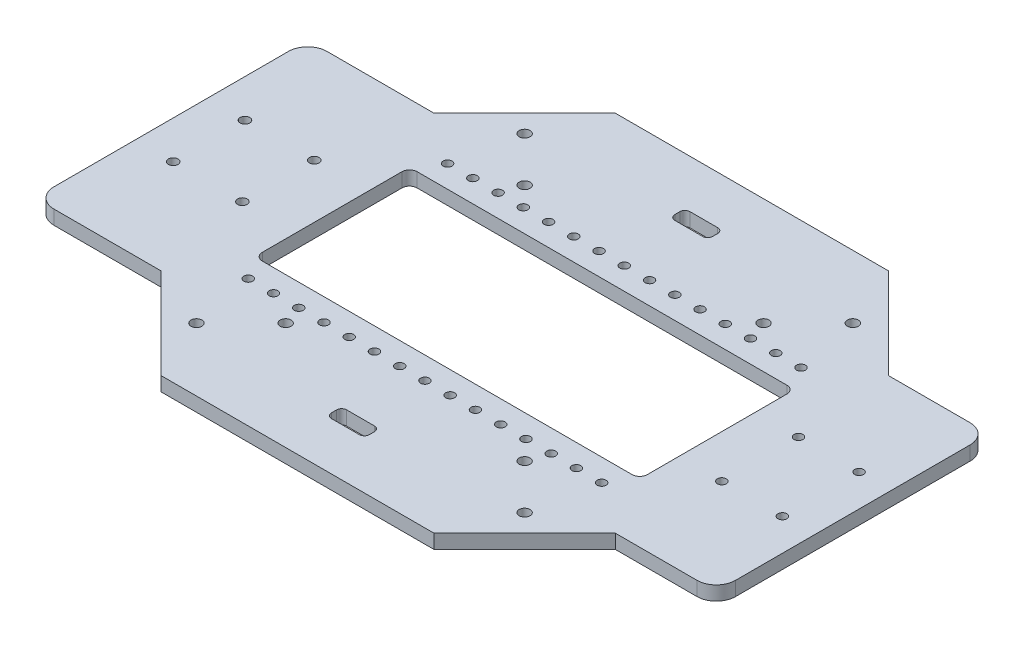
from build123d import *

# Parameters (mm, degrees)
BOSS_EXTRUDE1_DEPTH = 5.588
SKETCH2_R           = 2.159
CUT_EXTRUDE1_DEPTH  = 158.413946399
SKETCH3_W           = 152.51
SKETCH3_H           = 61.34
CUT_EXTRUDE2_DEPTH  = 158.413946399
BOSS_EXTRUDE2_DEPTH = 5.588
BOSS_EXTRUDE3_DEPTH = 5.588
SKETCH7_R           = 1.75
CUT_EXTRUDE4_DEPTH  = 187.865769606
SKETCH9_R           = 1.75
CUT_EXTRUDE8_DEPTH  = 187.865769606
CUT_EXTRUDE9_DEPTH  = 187.865769606
FILLET1_R           = 3
SKETCH11_R          = 1.905
CUT_EXTRUDE10_DEPTH = 187.865769606


with BuildPart() as part:
    # Sketch1 → Boss-Extrude1 (new body)
    with BuildSketch(Plane(origin=(0, 0, 0), x_dir=(1, 0, 0), z_dir=(0, 1, 0))):
        Polygon((-73.254183378, 28.522688753), (-37.333158894, 64.443713237), (70.824792138, 64.443713237), (106.745816622, 28.522688753), (106.745816622, -79.635262279), (70.824792138, -115.556286763), (-37.333158894, -115.556286763), (-73.254183378, -79.635262279), align=None)
    extrude(amount=BOSS_EXTRUDE1_DEPTH)

    # Sketch2 → Cut-Extrude1 (cut, through all)
    with BuildSketch(Plane(origin=(0, 5.588, 0), x_dir=(1, 0, 0), z_dir=(0, 1, 0))):
        with Locations(Location((-48.254183378, 39.443713237, 0), (0, 0, 270))):
            Circle(SKETCH2_R)
        with Locations(Location((-30.576513848, 21.766043708, 0), (0, 0, 270))):
            Circle(SKETCH2_R)
        with Locations(Location((-48.254183378, -90.556286763, 0), (0, 0, 270))):
            Circle(SKETCH2_R)
        with Locations(Location((-30.576513848, -72.878617233, 0), (0, 0, 270))):
            Circle(SKETCH2_R)
        with Locations(Location((64.068147093, 21.766043708, 0), (0, 0, 270))):
            Circle(SKETCH2_R)
        with Locations(Location((81.745816622, 39.443713237, 0), (0, 0, 270))):
            Circle(SKETCH2_R)
        with Locations(Location((64.068147093, -72.878617233, 0), (0, 0, 270))):
            Circle(SKETCH2_R)
        with Locations(Location((81.745816622, -90.556286763, 0), (0, 0, 270))):
            Circle(SKETCH2_R)
    extrude(amount=-CUT_EXTRUDE1_DEPTH, mode=Mode.SUBTRACT)

    # Sketch3 → Cut-Extrude2 (cut, through all)
    with BuildSketch(Plane(origin=(0, 5.588, 0), x_dir=(1, 0, 0), z_dir=(0, 1, 0))):
        with Locations((16.745816622, -25.556286763)):
            Rectangle(SKETCH3_W, SKETCH3_H)
    extrude(amount=-CUT_EXTRUDE2_DEPTH, mode=Mode.SUBTRACT)

    # Sketch5 → Boss-Extrude2 (add)
    with BuildSketch(Plane(origin=(0, 5.588, 0), x_dir=(1, 0, 0), z_dir=(0, 1, 0))):
        with BuildLine():
            Line((-73.254183378, -79.635262279), (-115.634183378, -79.635262279))
            ThreePointArc((-115.634183378, -79.635262279), (-121.02233705, -77.403415951), (-123.254183378, -72.015262279))
            Line((-123.254183378, -72.015262279), (-123.254183378, 20.902688753))
            ThreePointArc((-123.254183378, 20.902688753), (-121.02233705, 26.290842426), (-115.634183378, 28.522688753))
            Line((-115.634183378, 28.522688753), (-73.254183378, 28.522688753))
            Line((-73.254183378, 28.522688753), (-73.254183378, -79.635262279))
        make_face()
    extrude(amount=-BOSS_EXTRUDE2_DEPTH)

    # Sketch6 → Boss-Extrude3 (add)
    with BuildSketch(Plane(origin=(0, 5.588, 0), x_dir=(1, 0, 0), z_dir=(0, 1, 0))):
        with BuildLine():
            Line((106.745816622, 28.522688753), (139.125816622, 28.522688753))
            ThreePointArc((139.125816622, 28.522688753), (144.513970295, 26.290842426), (146.745816622, 20.902688753))
            Line((146.745816622, 20.902688753), (146.745816622, -72.015262279))
            ThreePointArc((146.745816622, -72.015262279), (144.513970295, -77.403415951), (139.125816622, -79.635262279))
            Line((139.125816622, -79.635262279), (106.745816622, -79.635262279))
            Line((106.745816622, -79.635262279), (106.745816622, 28.522688753))
        make_face()
    extrude(amount=-BOSS_EXTRUDE3_DEPTH)

    # Sketch7 → Cut-Extrude4 (cut, through all)
    with BuildSketch(Plane(origin=(0, 5.588, 0), x_dir=(1, 0, 0), z_dir=(0, 1, 0))):
        with Locations(Location((110.045816622, -10.356286763, 0), (0, 0, 270))):
            Circle(SKETCH7_R)
        with Locations(Location((134.045816622, -10.356286763, 0), (0, 0, 270))):
            Circle(SKETCH7_R)
        with Locations(Location((110.045816622, -40.756286763, 0), (0, 0, 270))):
            Circle(SKETCH7_R)
        with Locations(Location((134.045816622, -40.756286763, 0), (0, 0, 270))):
            Circle(SKETCH7_R)
    extrude(amount=-CUT_EXTRUDE4_DEPTH, mode=Mode.SUBTRACT)

    # Sketch9 → Cut-Extrude8 (cut, through all)
    with BuildSketch(Plane(origin=(0, 5.588, 0), x_dir=(1, 0, 0), z_dir=(0, 1, 0))):
        with Locations(Location((-53.254183378, 13.923713237, 0), (0, 0, 270))):
            Circle(SKETCH9_R)
        with Locations(Location((-43.254183378, 13.923713237, 0), (0, 0, 270))):
            Circle(SKETCH9_R)
        with Locations(Location((-33.254183378, 13.923713237, 0), (0, 0, 270))):
            Circle(SKETCH9_R)
        with Locations(Location((-23.254183378, 13.923713237, 0), (0, 0, 270))):
            Circle(SKETCH9_R)
        with Locations(Location((-13.254183378, 13.923713237, 0), (0, 0, 270))):
            Circle(SKETCH9_R)
        with Locations(Location((-3.254183378, 13.923713237, 0), (0, 0, 270))):
            Circle(SKETCH9_R)
        with Locations(Location((6.745816622, 13.923713237, 0), (0, 0, 270))):
            Circle(SKETCH9_R)
        with Locations(Location((16.745816622, 13.923713237, 0), (0, 0, 270))):
            Circle(SKETCH9_R)
        with Locations(Location((26.745816622, 13.923713237, 0), (0, 0, 270))):
            Circle(SKETCH9_R)
        with Locations(Location((36.745816622, 13.923713237, 0), (0, 0, 270))):
            Circle(SKETCH9_R)
        with Locations(Location((46.745816622, 13.923713237, 0), (0, 0, 270))):
            Circle(SKETCH9_R)
        with Locations(Location((56.745816622, 13.923713237, 0), (0, 0, 270))):
            Circle(SKETCH9_R)
        with Locations(Location((66.745816622, 13.923713237, 0), (0, 0, 270))):
            Circle(SKETCH9_R)
        with Locations(Location((76.745816622, 13.923713237, 0), (0, 0, 270))):
            Circle(SKETCH9_R)
        with Locations(Location((86.745816622, 13.923713237, 0), (0, 0, 270))):
            Circle(SKETCH9_R)
        with Locations(Location((-53.254183378, -65.036286763, 0), (0, 0, 270))):
            Circle(SKETCH9_R)
        with Locations(Location((-43.254183378, -65.036286763, 0), (0, 0, 270))):
            Circle(SKETCH9_R)
        with Locations(Location((-33.254183378, -65.036286763, 0), (0, 0, 270))):
            Circle(SKETCH9_R)
        with Locations(Location((-23.254183378, -65.036286763, 0), (0, 0, 270))):
            Circle(SKETCH9_R)
        with Locations(Location((-13.254183378, -65.036286763, 0), (0, 0, 270))):
            Circle(SKETCH9_R)
        with Locations(Location((-3.254183378, -65.036286763, 0), (0, 0, 270))):
            Circle(SKETCH9_R)
        with Locations(Location((6.745816622, -65.036286763, 0), (0, 0, 270))):
            Circle(SKETCH9_R)
        with Locations(Location((16.745816622, -65.036286763, 0), (0, 0, 270))):
            Circle(SKETCH9_R)
        with Locations(Location((26.745816622, -65.036286763, 0), (0, 0, 270))):
            Circle(SKETCH9_R)
        with Locations(Location((36.745816622, -65.036286763, 0), (0, 0, 270))):
            Circle(SKETCH9_R)
        with Locations(Location((46.745816622, -65.036286763, 0), (0, 0, 270))):
            Circle(SKETCH9_R)
        with Locations(Location((56.745816622, -65.036286763, 0), (0, 0, 270))):
            Circle(SKETCH9_R)
        with Locations(Location((66.745816622, -65.036286763, 0), (0, 0, 270))):
            Circle(SKETCH9_R)
        with Locations(Location((76.745816622, -65.036286763, 0), (0, 0, 270))):
            Circle(SKETCH9_R)
        with Locations(Location((86.745816622, -65.036286763, 0), (0, 0, 270))):
            Circle(SKETCH9_R)
    extrude(amount=-CUT_EXTRUDE8_DEPTH, mode=Mode.SUBTRACT)

    # Sketch10 → Cut-Extrude9 (cut, through all)
    with BuildSketch(Plane(origin=(0, 5.588, 0), x_dir=(1, 0, 0), z_dir=(0, 1, 0))):
        with BuildLine():
            Line((11.245816622, 45.443713237), (22.245816622, 45.443713237))
            ThreePointArc((22.245816622, 45.443713237), (23.660030185, 44.8579268), (24.245816622, 43.443713237))
            Line((24.245816622, 43.443713237), (24.245816622, 41.443713237))
            ThreePointArc((24.245816622, 41.443713237), (23.660030185, 40.029499675), (22.245816622, 39.443713237))
            Line((22.245816622, 39.443713237), (11.245816622, 39.443713237))
            ThreePointArc((11.245816622, 39.443713237), (9.83160306, 40.029499675), (9.245816622, 41.443713237))
            Line((9.245816622, 41.443713237), (9.245816622, 43.443713237))
            ThreePointArc((9.245816622, 43.443713237), (9.83160306, 44.8579268), (11.245816622, 45.443713237))
        make_face()
        with BuildLine():
            Line((11.245816622, -90.556286763), (22.245816622, -90.556286763))
            ThreePointArc((22.245816622, -90.556286763), (23.660030185, -91.1420732), (24.245816622, -92.556286763))
            Line((24.245816622, -92.556286763), (24.245816622, -94.556286763))
            ThreePointArc((24.245816622, -94.556286763), (23.660030185, -95.970500325), (22.245816622, -96.556286763))
            Line((22.245816622, -96.556286763), (11.245816622, -96.556286763))
            ThreePointArc((11.245816622, -96.556286763), (9.83160306, -95.970500325), (9.245816622, -94.556286763))
            Line((9.245816622, -94.556286763), (9.245816622, -92.556286763))
            ThreePointArc((9.245816622, -92.556286763), (9.83160306, -91.1420732), (11.245816622, -90.556286763))
        make_face()
    extrude(amount=-CUT_EXTRUDE9_DEPTH, mode=Mode.SUBTRACT)

    # Fillet1
    fillet1_edges = [part.edges().sort_by_distance(p)[0] for p in [
        (-59.509183378, 2.794, 56.226286763),
        (-59.509183378, 2.794, -5.113713237),
        (93.000816622, 2.794, -5.113713237),
        (93.000816622, 2.794, 56.226286763),
    ]]
    fillet(fillet1_edges, radius=FILLET1_R)

    # Sketch11 → Cut-Extrude10 (cut, through all)
    with BuildSketch(Plane(origin=(0, 5.588, 0), x_dir=(1, 0, 0), z_dir=(0, 1, 0))):
        with Locations(Location((-108.254183378, -11.332286763, 0), (0, 0, 270))):
            Circle(SKETCH11_R)
        with Locations(Location((-80.822183378, -11.332286763, 0), (0, 0, 270))):
            Circle(SKETCH11_R)
        with Locations(Location((-80.822183378, -39.780286763, 0), (0, 0, 270))):
            Circle(SKETCH11_R)
        with Locations(Location((-108.254183378, -39.780286763, 0), (0, 0, 270))):
            Circle(SKETCH11_R)
    extrude(amount=-CUT_EXTRUDE10_DEPTH, mode=Mode.SUBTRACT)


solid = part.part
